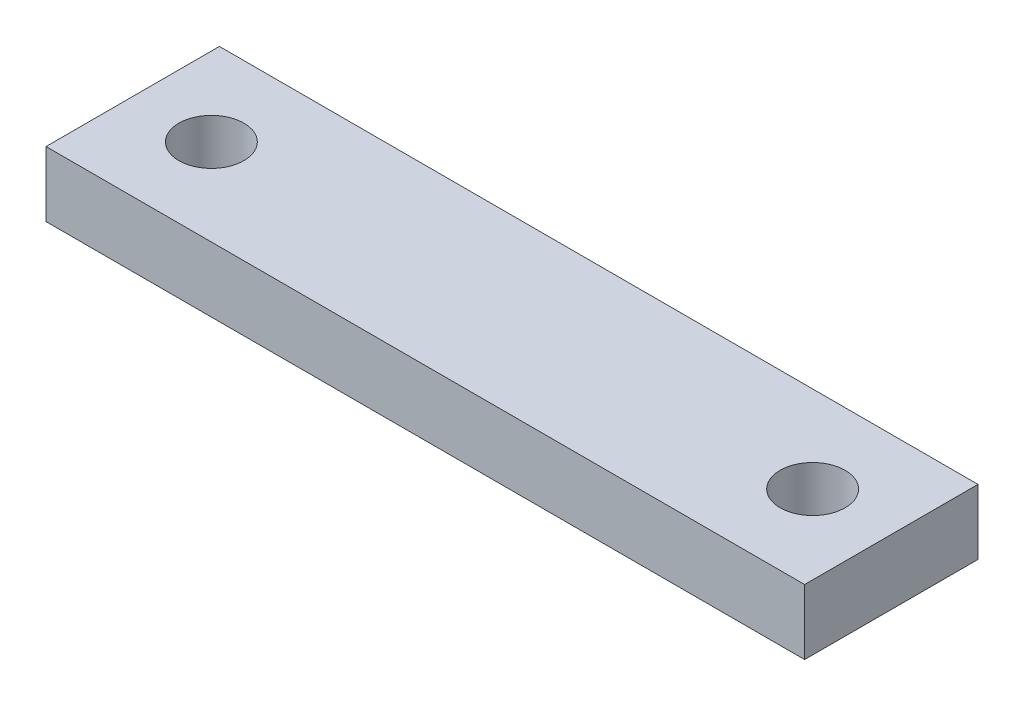
from build123d import *

# Parameters (mm, degrees)
SKETCH1_W           = 35
SKETCH1_H           = 8
SKETCH1_R           = 1.5
BOSS_EXTRUDE1_DEPTH = 3


with BuildPart() as part:
    # Sketch1 → Boss-Extrude1 (new body)
    with BuildSketch(Plane(origin=(0, 0, 0), x_dir=(1, 0, 0), z_dir=(0, 1, 0))):
        Rectangle(SKETCH1_W, SKETCH1_H)
        with Locations(Location((-13.87, 0, 0), (0, 0, 270))):
            Circle(SKETCH1_R, mode=Mode.SUBTRACT)
        with Locations(Location((13.87, 0, 0), (0, 0, 90))):
            Circle(SKETCH1_R, mode=Mode.SUBTRACT)
    extrude(amount=BOSS_EXTRUDE1_DEPTH)


solid = part.part
